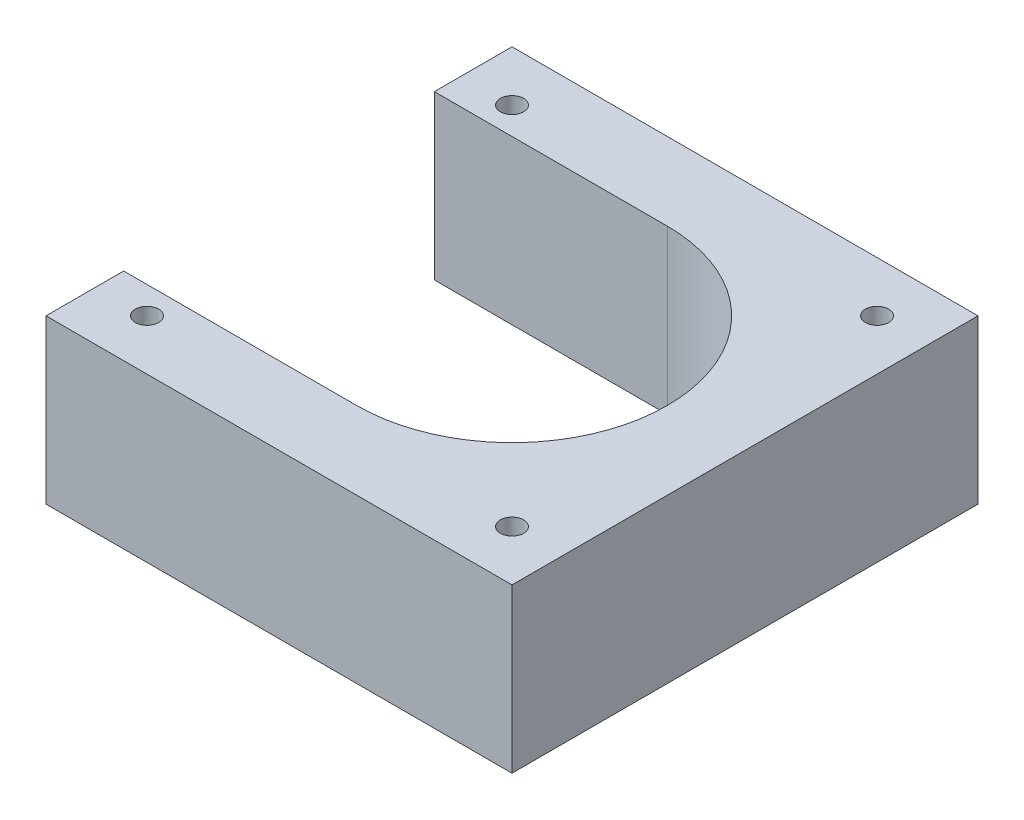
from build123d import *

# Parameters (mm, degrees)
SKETCH1_R           = 1.5
BOSS_EXTRUDE1_DEPTH = 21


with BuildPart() as part:
    # Sketch1 → Boss-Extrude1 (new body)
    with BuildSketch(Plane(origin=(0, 0, 0), x_dir=(1, 0, 0), z_dir=(0, 1, 0))):
        with BuildLine():
            Line((0, 20), (-30, 20))
            Line((-30, 20), (-30, 30))
            Line((-30, 30), (30, 30))
            Line((30, 30), (30, -30))
            Line((30, -30), (-30, -30))
            Line((-30, -30), (-30, -20))
            Line((-30, -20), (0, -20))
            ThreePointArc((0, -20), (20, 0), (0, 20))
        make_face()
        with Locations(Location((-23.5, 23.5, 0), (0, 0, 90))):
            Circle(SKETCH1_R, mode=Mode.SUBTRACT)
        with Locations(Location((23.5, 23.5, 0), (0, 0, 90))):
            Circle(SKETCH1_R, mode=Mode.SUBTRACT)
        with Locations(Location((-23.5, -23.5, 0), (0, 0, 90))):
            Circle(SKETCH1_R, mode=Mode.SUBTRACT)
        with Locations(Location((23.5, -23.5, 0), (0, 0, 90))):
            Circle(SKETCH1_R, mode=Mode.SUBTRACT)
    extrude(amount=BOSS_EXTRUDE1_DEPTH)


solid = part.part
